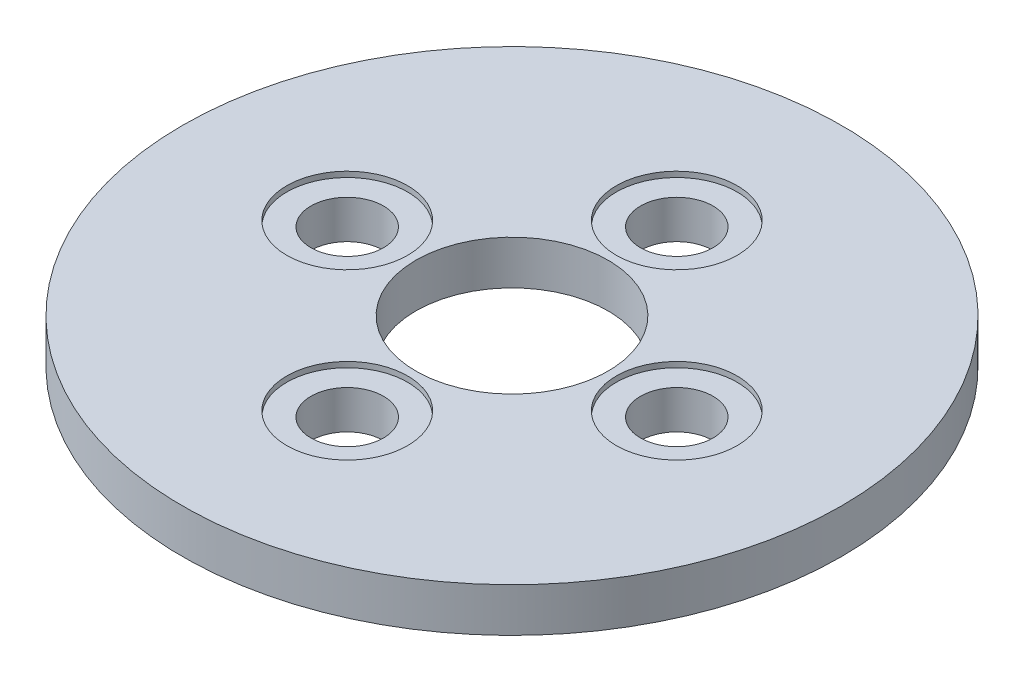
from build123d import *

# Parameters (mm, degrees)
SKETCH_1_W                   = 21.25
SKETCH_1_H                   = 4
HOLE_WIZARD_M6_1_D           = 6.6
HOLE_WIZARD_M6_1_CBORE_D     = 11
HOLE_WIZARD_M6_1_CBORE_DEPTH = 0.5


with BuildPart() as part:
    # 草图1 → 旋转1 (revolve)
    with BuildSketch(Plane.XY, mode=Mode.PRIVATE) as revolve_1_sk:
        with Locations((19.375, 2)):
            Rectangle(SKETCH_1_W, SKETCH_1_H)
    revolve(revolve_1_sk.sketch.rotate(Axis((0, 4, 0), (0, -1, 0)), 180), axis=Axis((0, 4, 0), (0, -1, 0)))

    # M6 六角头螺栓的柱形沉头孔1 (through all)
    with Locations(Plane(origin=(0, 4, 0), x_dir=(1, 0, 0), z_dir=(0, 1, 0))):
        with Locations((15, 0), (0, -15), (-15, 0), (0, 15)):
            CounterBoreHole(HOLE_WIZARD_M6_1_D / 2, HOLE_WIZARD_M6_1_CBORE_D / 2, HOLE_WIZARD_M6_1_CBORE_DEPTH)


solid = part.part
